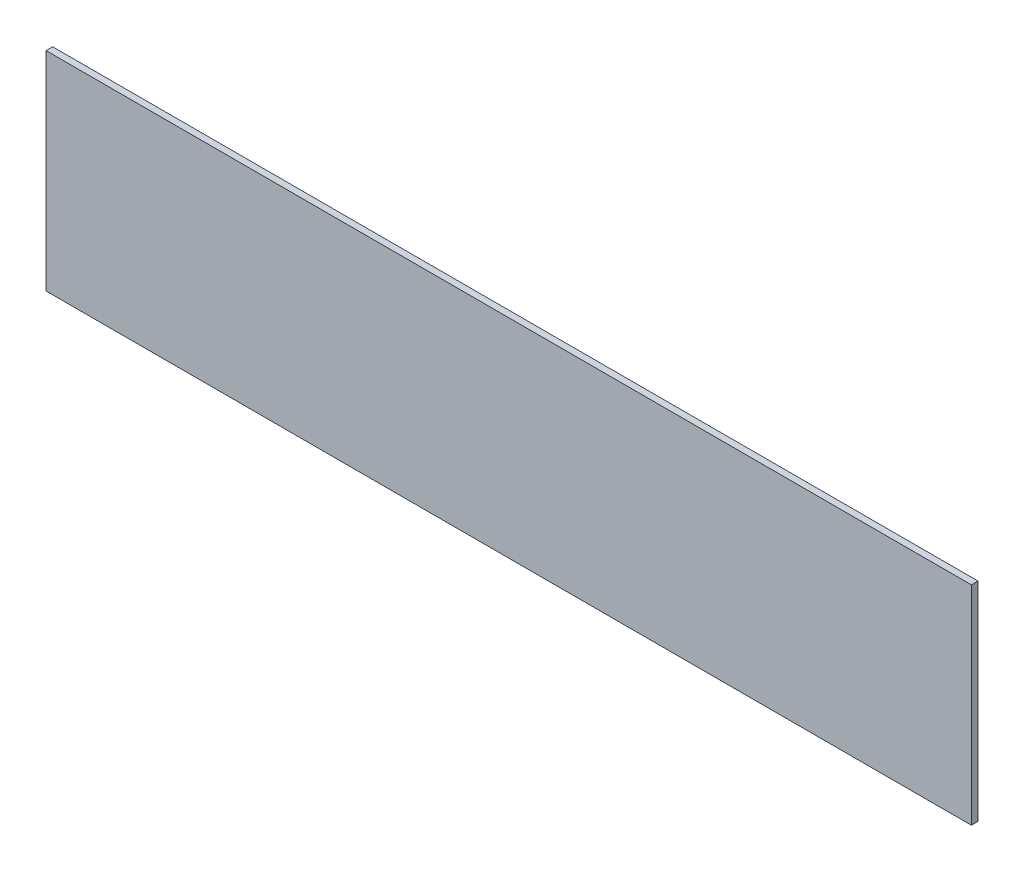
from build123d import *

# Parameters (mm, degrees)
SKETCH1_W           = 444.5
SKETCH1_H           = 100.0125
BOSS_EXTRUDE1_DEPTH = 3.175


with BuildPart() as part:
    # Sketch1 → Boss-Extrude1 (new body)
    with BuildSketch(Plane.XY):
        with Locations((-166.655712251, 16.446283615)):
            Rectangle(SKETCH1_W, SKETCH1_H)
    extrude(amount=-BOSS_EXTRUDE1_DEPTH)


solid = part.part
